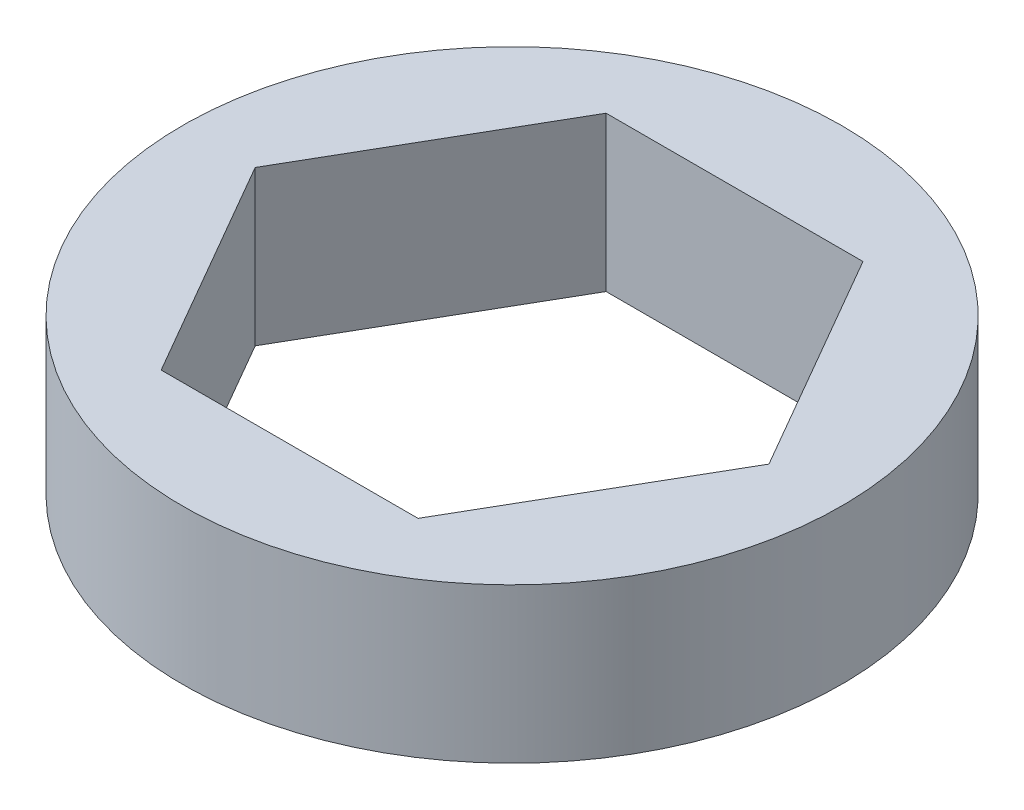
from build123d import *

# Parameters (mm, degrees)
SKETCH1_R           = 10.16
BOSS_EXTRUDE1_DEPTH = 4.7625


with BuildPart() as part:
    # Sketch1 → Boss-Extrude1 (new body)
    with BuildSketch(Plane(origin=(0, 0, 0), x_dir=(1, 0, 0), z_dir=(0, 1, 0))):
        with Locations(Location((0, 0, 0), (0, 0, 90))):
            Circle(SKETCH1_R)
        Polygon((7.918936292, 0), (3.959468146, 6.858), (-3.959468146, 6.858), (-7.918936292, 0), (-3.959468146, -6.858), (3.959468146, -6.858), align=None, mode=Mode.SUBTRACT)
    extrude(amount=BOSS_EXTRUDE1_DEPTH)


solid = part.part
